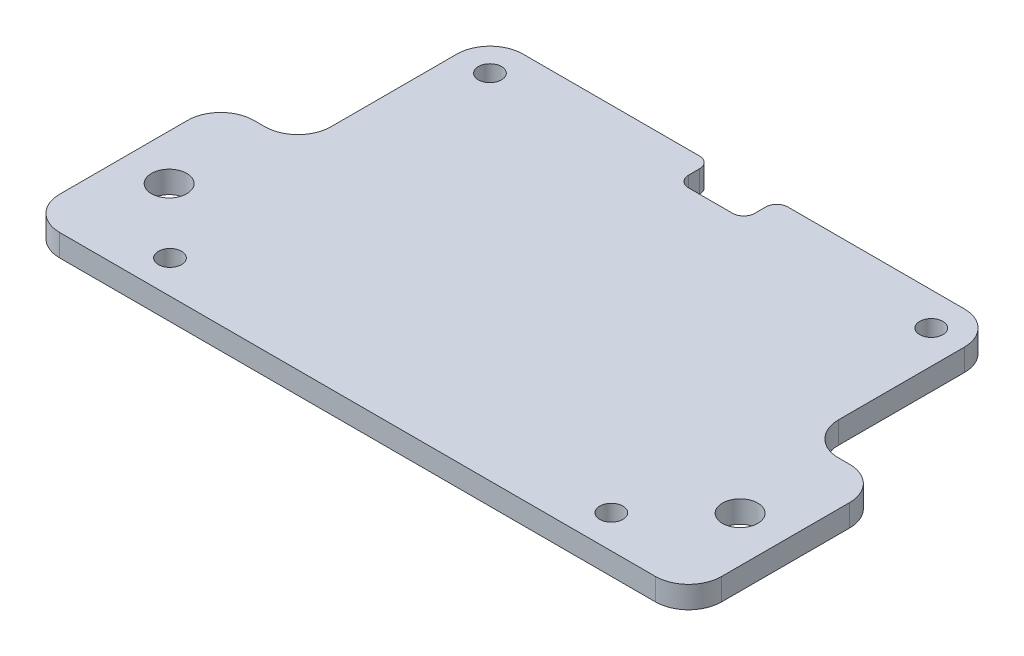
from build123d import *

# Parameters (mm, degrees)
SKETCH1_R           = 1.6
SKETCH1_R_2         = 1.05
BOSS_EXTRUDE1_DEPTH = 2
FILLET1_R           = 3
FILLET2_R           = 1


with BuildPart() as part:
    # Sketch1 → Boss-Extrude1 (new body)
    with BuildSketch(Plane(origin=(0, 0, 0), x_dir=(1, 0, 0), z_dir=(0, 1, 0))):
        Polygon((-27.060616409, 17.5), (-27.060616409, 14.5), (-33.060616409, 14.5), (-33.060616409, 17.5), (-53.060616409, 17.5), (-53.060616409, 0.1), (-60.060616409, 0.1), (-60.060616409, -17.5), (-30.060616409, -17.5), (-0.060616409, -17.5), (-0.060616409, 0.1), (-7.060616409, 0.1), (-7.060616409, 17.5), align=None)
        with Locations(Location((-4.185616409, -8.7, 0), (0, 0, 270))):
            Circle(SKETCH1_R, mode=Mode.SUBTRACT)
        with Locations(Location((-55.935616409, -8.7, 0), (0, 0, 270))):
            Circle(SKETCH1_R, mode=Mode.SUBTRACT)
        with Locations(Location((-10.060616409, -14.5, 0), (0, 0, 270))):
            Circle(SKETCH1_R_2, mode=Mode.SUBTRACT)
        with Locations(Location((-50.060616409, -14.5, 0), (0, 0, 270))):
            Circle(SKETCH1_R_2, mode=Mode.SUBTRACT)
        with Locations(Location((-50.060616409, 14.5, 0), (0, 0, 270))):
            Circle(SKETCH1_R_2, mode=Mode.SUBTRACT)
        with Locations(Location((-10.060616409, 14.5, 0), (0, 0, 270))):
            Circle(SKETCH1_R_2, mode=Mode.SUBTRACT)
    extrude(amount=BOSS_EXTRUDE1_DEPTH)

    # Fillet1
    fillet1_edges = [part.edges().sort_by_distance(p)[0] for p in [
        (-7.060616409, 1, -17.5),
        (-7.060616409, 1, -0.1),
        (-0.060616409, 1, -0.1),
        (-0.060616409, 1, 17.5),
        (-60.060616409, 1, 17.5),
        (-60.060616409, 1, -0.1),
        (-53.060616409, 1, -0.1),
        (-53.060616409, 1, -17.5),
    ]]
    fillet(fillet1_edges, radius=FILLET1_R)

    # Fillet2
    fillet2_edges = [part.edges().sort_by_distance(p)[0] for p in [
        (-33.060616409, 1, -17.5),
        (-33.060616409, 1, -14.5),
        (-27.060616409, 1, -14.5),
        (-27.060616409, 1, -17.5),
    ]]
    fillet(fillet2_edges, radius=FILLET2_R)


solid = part.part
